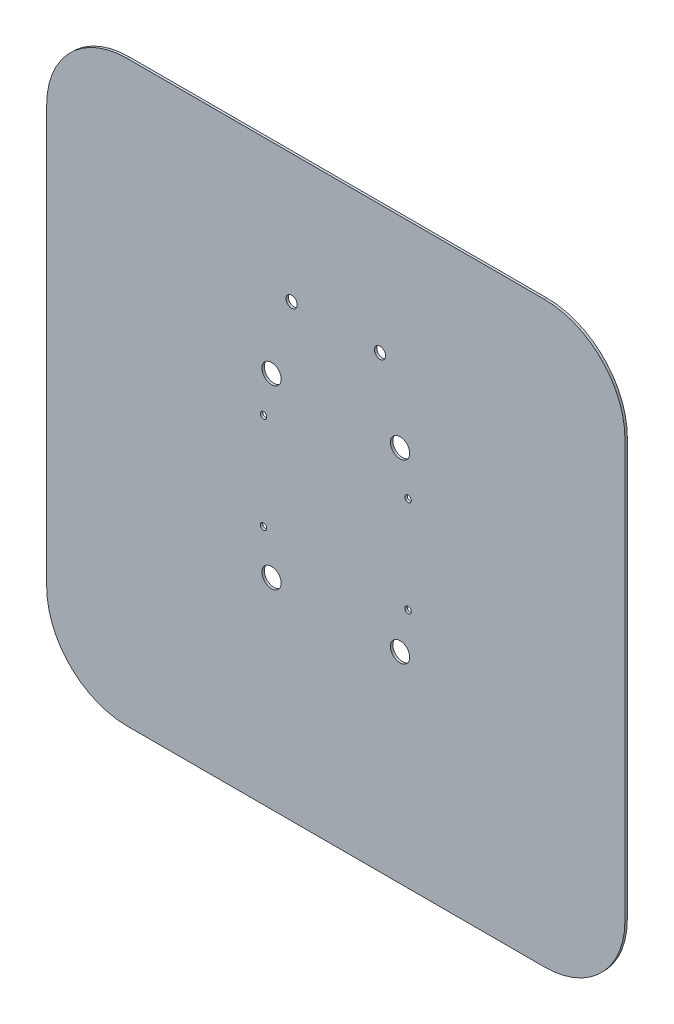
from build123d import *

# Parameters (mm, degrees)
BOSS_EXTRUDE1_DEPTH      = 1.5
F_4_0_4_DIAMETER_HOLE1_D = 4
F_7_0_7_DIAMETER_HOLE1_D = 7
F_12_0MM_DOWEL_HOLE1_D   = 12


with BuildPart() as part:
    # Sketch1 → Boss-Extrude1 (new body)
    with BuildSketch(Plane.XY):
        with BuildLine():
            Line((50, 0), (310, 0))
            ThreePointArc((310, 0), (345.355339059, 14.644660941), (360, 50))
            Line((360, 50), (360, 310))
            ThreePointArc((360, 310), (345.355339059, 345.355339059), (310, 360))
            Line((310, 360), (50, 360))
            ThreePointArc((50, 360), (14.644660941, 345.355339059), (0, 310))
            Line((0, 310), (0, 50))
            ThreePointArc((0, 50), (14.644660941, 14.644660941), (50, 0))
        make_face()
    extrude(amount=BOSS_EXTRUDE1_DEPTH)

    # Ø4.0 (4) Diameter Hole1 (through all)
    with Locations(Plane(origin=(135, 210, 1.5), x_dir=(1, 0, 0), z_dir=(0, 0, 1))):
        with Locations((0, 0), (90, 0), (90, -60), (0, -60)):
            Hole(F_4_0_4_DIAMETER_HOLE1_D / 2)

    # Ø7.0 (7) Diameter Hole1 (through all)
    with Locations(Plane(origin=(152.5, 280, 1.5), x_dir=(1, 0, 0), z_dir=(0, 0, 1))):
        with Locations((0, 0), (55, 0)):
            Hole(F_7_0_7_DIAMETER_HOLE1_D / 2)

    # Ø12.0mm Dowel Hole1 (through all)
    with Locations(Plane(origin=(140, 235, 1.5), x_dir=(1, 0, 0), z_dir=(0, 0, 1))):
        with Locations((0, 0), (80, 0), (0, -110), (80, -110)):
            Hole(F_12_0MM_DOWEL_HOLE1_D / 2)


solid = part.part
